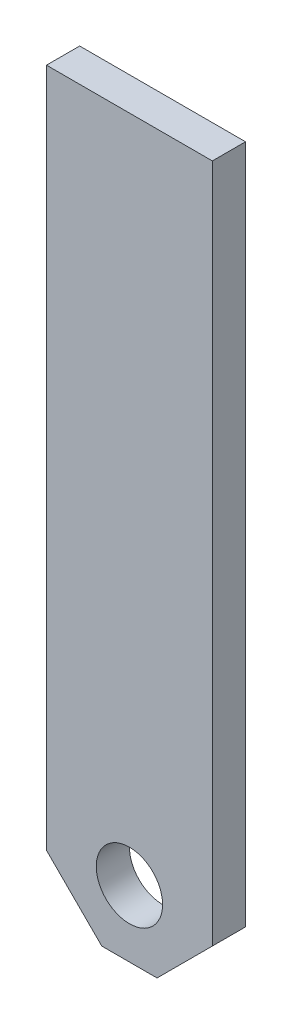
from build123d import *

# Parameters (mm, degrees)
SKETCH_1_W          = 30
SKETCH_1_H          = 133
EXTRUDE_1_DEPTH     = 6
CHAMFER_1_SIZE      = 10
SKETCH_2_R          = 6
CUT_EXTRUDE_1_DEPTH = 134.97761007


with BuildPart() as part:
    # Эскиз1 → Бобышка-Вытянуть1 (new body)
    with BuildSketch(Plane.XY):
        with Locations((0, -66.5)):
            Rectangle(SKETCH_1_W, SKETCH_1_H)
    extrude(amount=-EXTRUDE_1_DEPTH)

    # Фаска1
    chamfer_1_edges = [part.edges().sort_by_distance(p)[0] for p in [
        (15, -133, -3),
        (-15, -133, -3),
    ]]
    chamfer(chamfer_1_edges, length=CHAMFER_1_SIZE)

    # Эскиз2 → Вырез-Вытянуть1 (cut, through all)
    with BuildSketch(Plane.XY):
        with Locations((0, -121)):
            Circle(SKETCH_2_R)
    extrude(amount=-CUT_EXTRUDE_1_DEPTH, mode=Mode.SUBTRACT)


solid = part.part
